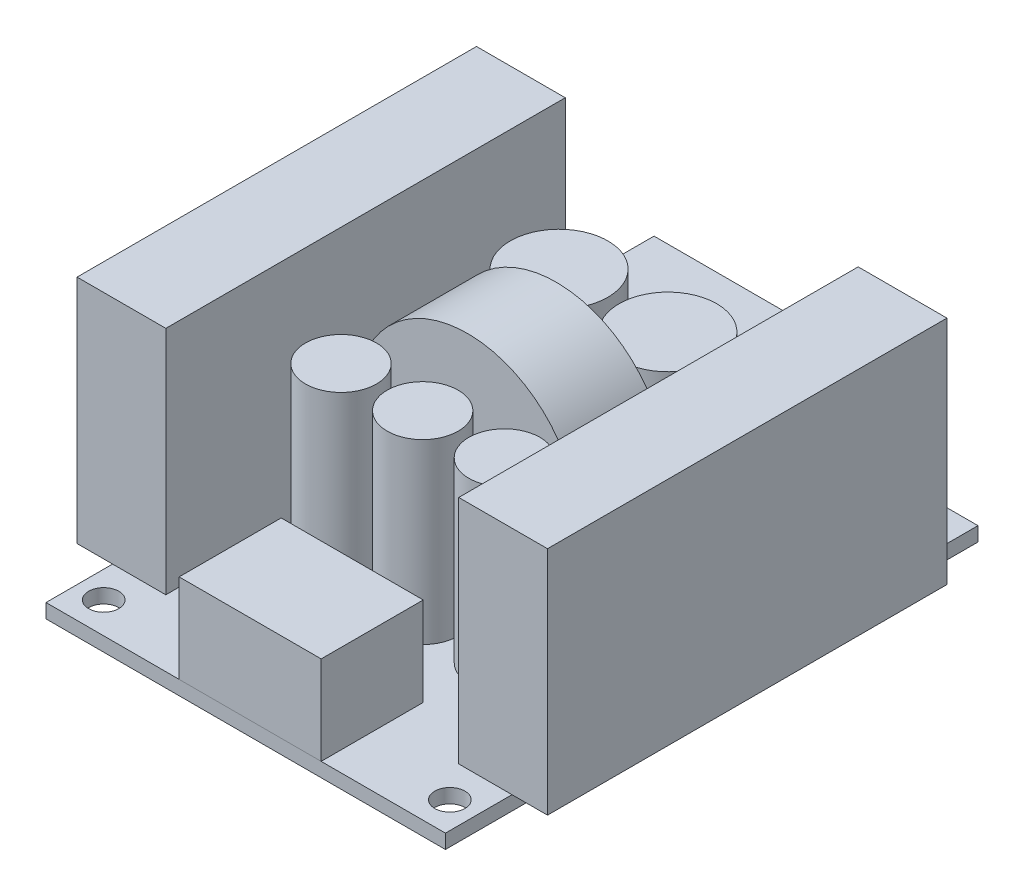
from build123d import *

# Parameters (mm, degrees)
ESQUISSE1_W               = 45
ESQUISSE1_H               = 60
BOSS_EXTRU_1_DEPTH        = 1.6
ESQUISSE2_W               = 10
ESQUISSE2_H               = 45
BOSS_EXTRU_2_DEPTH        = 26
BOSS_EXTRU_2_2_DEPTH      = 26
ESQUISSE5_W               = 1.7
ESQUISSE5_H               = 1.6
D_GAGEMENT_M31_AT_2_COUNT = 2
D_GAGEMENT_M31_AT_2_PITCH = 53
D_GAGEMENT_M31_AT_3_COUNT = 2
D_GAGEMENT_M31_AT_3_PITCH = 39
D_GAGEMENT_M31_AT_4_COUNT = 2
D_GAGEMENT_M31_AT_4_PITCH = 65.802735505
ESQUISSE6_W               = 16
ESQUISSE6_H               = 11.5
BOSS_EXTRU_3_DEPTH        = 10
BOSS_EXTRU_3_2_DEPTH      = 10
ESQUISSE8_R               = 12.5
BOSS_EXTRU_6_DEPTH        = 5
ESQUISSE7_R               = 5.5
BOSS_EXTRU_4_DEPTH        = 20
BOSS_EXTRU_4_2_DEPTH      = 20
ESQUISSE7_R_2             = 4
BOSS_EXTRU_4_3_DEPTH      = 20
BOSS_EXTRU_4_4_DEPTH      = 20
BOSS_EXTRU_4_5_DEPTH      = 20


with BuildPart() as part:
    # Esquisse1 → Boss.-Extru.1 (new body)
    with BuildSketch(Plane(origin=(0, 0, 0), x_dir=(1, 0, 0), z_dir=(0, 1, 0))):
        Rectangle(ESQUISSE1_W, ESQUISSE1_H)
    extrude(amount=BOSS_EXTRU_1_DEPTH)

    # Esquisse5 → Dégagement M31 (revolve, cut)
    with BuildSketch(Plane(origin=(-19.5, 1.6, -26.5), x_dir=(0, 0, 1), z_dir=(1, 0, 0))):
        with Locations((0.85, 0.8)):
            Rectangle(ESQUISSE5_W, ESQUISSE5_H)
    d_gagement_m31 = revolve(axis=Axis((-19.5, 7.95, -26.5), (0, -1, 0)), mode=Mode.SUBTRACT)

    # Dégagement M31 at 2: Dégagement M31 ×2
    with Locations(*[(0, 0, i * D_GAGEMENT_M31_AT_2_PITCH) for i in range(1, D_GAGEMENT_M31_AT_2_COUNT)]):
        add(d_gagement_m31, mode=Mode.SUBTRACT)

    # Dégagement M31 at 3: Dégagement M31 ×2
    with Locations(*[(i * D_GAGEMENT_M31_AT_3_PITCH, 0, 0) for i in range(1, D_GAGEMENT_M31_AT_3_COUNT)]):
        add(d_gagement_m31, mode=Mode.SUBTRACT)

    # Dégagement M31 at 4: Dégagement M31 ×2
    with Locations(*[Vector(0.5926805276472259, 0, 0.8054376401359735) * (i * D_GAGEMENT_M31_AT_4_PITCH) for i in range(1, D_GAGEMENT_M31_AT_4_COUNT)]):
        add(d_gagement_m31, mode=Mode.SUBTRACT)


with BuildPart() as body_2:
    # Esquisse2 → Boss.-Extru.2 (new body)
    with BuildSketch(Plane(origin=(0, 1.6, 0), x_dir=(1, 0, 0), z_dir=(0, 1, 0))):
        with Locations((-21.5, 0)):
            Rectangle(ESQUISSE2_W, ESQUISSE2_H)
    extrude(amount=BOSS_EXTRU_2_DEPTH)


with BuildPart() as body_3:
    # Esquisse2 → Boss.-Extru.2 2 (new body)
    with BuildSketch(Plane(origin=(0, 1.6, 0), x_dir=(1, 0, 0), z_dir=(0, 1, 0))):
        with Locations((21.5, 0)):
            Rectangle(ESQUISSE2_W, ESQUISSE2_H)
    extrude(amount=BOSS_EXTRU_2_2_DEPTH)


with BuildPart() as body_4:
    # Esquisse6 → Boss.-Extru.3 (new body)
    with BuildSketch(Plane(origin=(0, 1.6, 0), x_dir=(1, 0, 0), z_dir=(0, 1, 0))):
        with Locations((0.5, -24.25)):
            Rectangle(ESQUISSE6_W, ESQUISSE6_H)
    extrude(amount=BOSS_EXTRU_3_DEPTH)


with BuildPart() as body_5:
    # Esquisse6 → Boss.-Extru.3 2 (new body)
    with BuildSketch(Plane(origin=(0, 1.6, 0), x_dir=(1, 0, 0), z_dir=(0, 1, 0))):
        with Locations((-6, 24.25)):
            Rectangle(ESQUISSE6_W, ESQUISSE6_H)
    extrude(amount=BOSS_EXTRU_3_2_DEPTH)


with BuildPart() as body_6:
    # Esquisse8 → Boss.-Extru.6 (new, symmetric)
    with BuildSketch(Plane.XY):
        with Locations((0, 14.1)):
            Circle(ESQUISSE8_R)
    extrude(amount=BOSS_EXTRU_6_DEPTH, both=True)


with BuildPart() as body_7:
    # Esquisse7 → Boss.-Extru.4 (new body)
    with BuildSketch(Plane(origin=(0, 1.6, 0), x_dir=(1, 0, 0), z_dir=(0, 1, 0))):
        with Locations(Location((-6.130897593, 11.433498553, 0), (0, 0, 270))):
            Circle(ESQUISSE7_R)
    extrude(amount=BOSS_EXTRU_4_DEPTH)


with BuildPart() as body_8:
    # Esquisse7 → Boss.-Extru.4 2 (new body)
    with BuildSketch(Plane(origin=(0, 1.6, 0), x_dir=(1, 0, 0), z_dir=(0, 1, 0))):
        with Locations(Location((6.130897593, 11.433498553, 0), (0, 0, 90))):
            Circle(ESQUISSE7_R)
    extrude(amount=BOSS_EXTRU_4_2_DEPTH)


with BuildPart() as body_9:
    # Esquisse7 → Boss.-Extru.4 3 (new body)
    with BuildSketch(Plane(origin=(0, 1.6, 0), x_dir=(1, 0, 0), z_dir=(0, 1, 0))):
        with Locations(Location((0, -10.061105761, 0), (0, 0, 270))):
            Circle(ESQUISSE7_R_2)
    extrude(amount=BOSS_EXTRU_4_3_DEPTH)


with BuildPart() as body_10:
    # Esquisse7 → Boss.-Extru.4 4 (new body)
    with BuildSketch(Plane(origin=(0, 1.6, 0), x_dir=(1, 0, 0), z_dir=(0, 1, 0))):
        with Locations(Location((-9.204902398, -10.061105761, 0), (0, 0, 270))):
            Circle(ESQUISSE7_R_2)
    extrude(amount=BOSS_EXTRU_4_4_DEPTH)


with BuildPart() as body_11:
    # Esquisse7 → Boss.-Extru.4 5 (new body)
    with BuildSketch(Plane(origin=(0, 1.6, 0), x_dir=(1, 0, 0), z_dir=(0, 1, 0))):
        with Locations(Location((9.204902398, -10.061105761, 0), (0, 0, 90))):
            Circle(ESQUISSE7_R_2)
    extrude(amount=BOSS_EXTRU_4_5_DEPTH)


solid = Compound([part.part, body_2.part, body_3.part, body_4.part, body_5.part, body_6.part, body_7.part, body_8.part, body_9.part, body_10.part, body_11.part])
